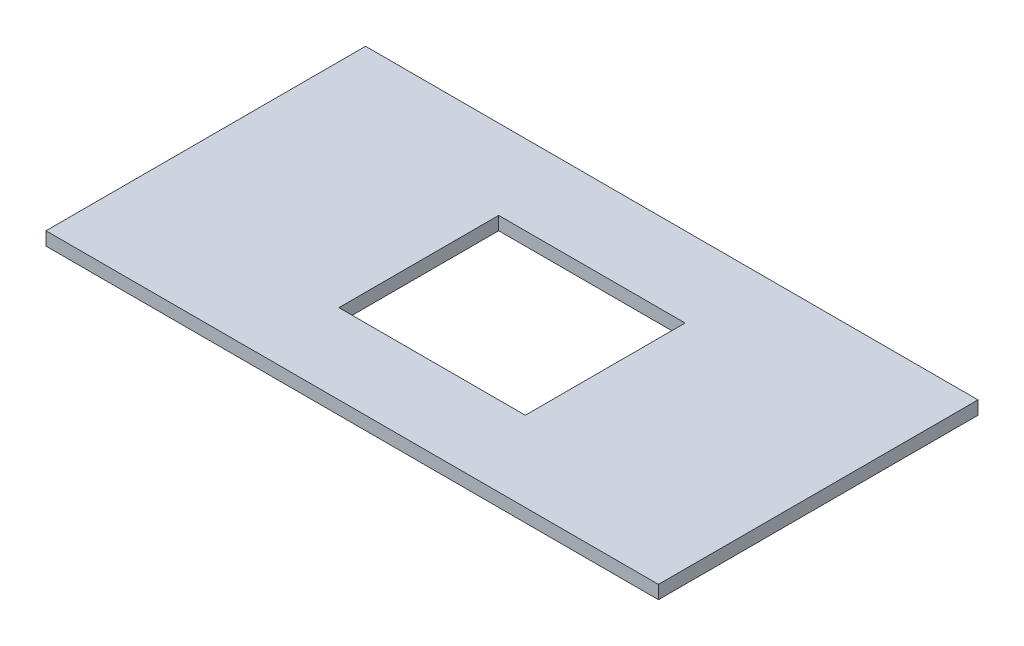
from build123d import *

# Parameters (mm, degrees)
SKETCH1_W           = 146.05
SKETCH1_H           = 76.2
SKETCH1_W_2         = 44.45
SKETCH1_H_2         = 38.1
BOSS_EXTRUDE1_DEPTH = 3.175


with BuildPart() as part:
    # Sketch1 → Boss-Extrude1 (new body)
    with BuildSketch(Plane(origin=(0, 0, 0), x_dir=(1, 0, 0), z_dir=(0, 1, 0))):
        with Locations((73.025, 38.1)):
            Rectangle(SKETCH1_W, SKETCH1_H)
        with Locations((73.025, 38.1)):
            Rectangle(SKETCH1_W_2, SKETCH1_H_2, mode=Mode.SUBTRACT)
    extrude(amount=BOSS_EXTRUDE1_DEPTH)


solid = part.part
